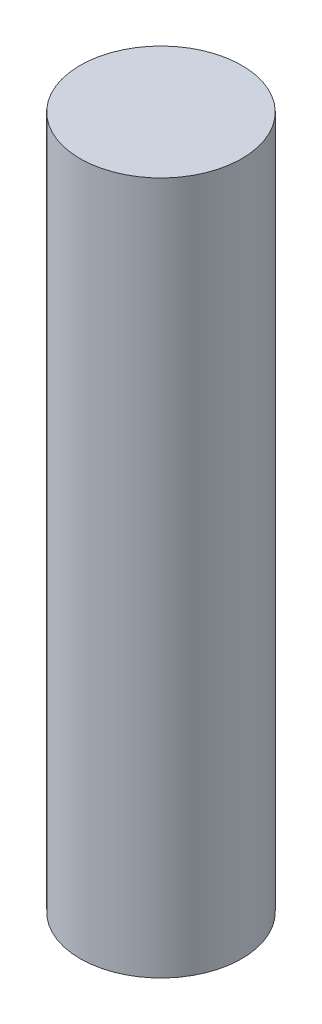
from build123d import *

# Parameters (mm, degrees)
SKETCH1_R           = 3.5
BOSS_EXTRUDE1_DEPTH = 30


with BuildPart() as part:
    # Sketch1 → Boss-Extrude1 (new body)
    with BuildSketch(Plane(origin=(0, 0, 0), x_dir=(1, 0, 0), z_dir=(0, 1, 0))):
        with Locations(Location((0, 0, 0), (0, 0, 270))):
            Circle(SKETCH1_R)
    extrude(amount=BOSS_EXTRUDE1_DEPTH)


solid = part.part
